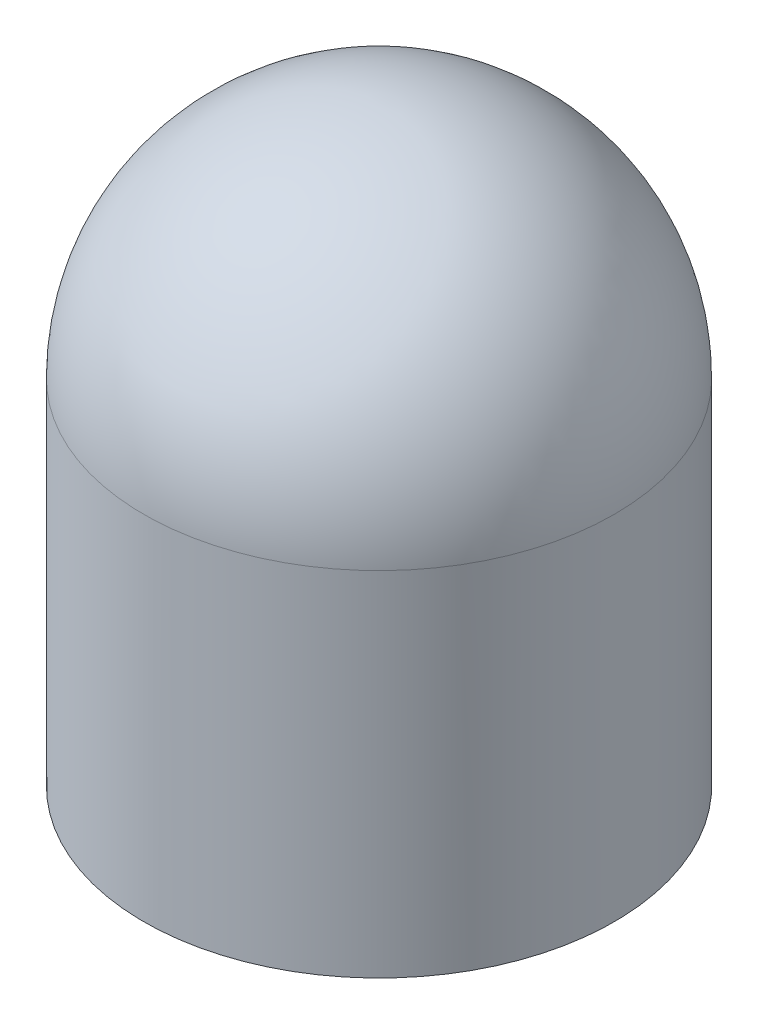
from build123d import *

# Parameters (mm, degrees)
ENL_V_MAT_EXTRU_1_DEPTH = 1


with BuildPart() as part:
    # Esquisse2 → Révolution2 (revolve)
    with BuildSketch(Plane.XY):
        with BuildLine():
            Line((-1.5, -3), (-1.5, -6))
            Line((-1.5, -6), (-4, -6))
            Line((-4, -6), (-4, 0))
            ThreePointArc((-4, 0), (-2.828427125, 2.828427125), (0, 4))
            Line((0, 4), (0, -3))
            Line((0, -3), (-1.5, -3))
        make_face()
    revolve(axis=Axis((0, 4, 0), (0, -1, 0)))

    # Esquisse3 → Enlèv. mat.-Extru.1 (cut)
    with BuildSketch(Plane.XZ.offset(6)):
        with BuildLine():
            add(Edge.make_bspline(
                [(-1.80863124, 2.541345123), (-1.808479721, 2.566576945), (-1.808185465, 2.615578129), (-1.805014729, 2.686862301), (-1.799544973, 2.753773198), (-1.792519265, 2.816312807), (-1.782799384, 2.874524095), (-1.771677826, 2.928435828), (-1.75798753, 2.978054639), (-1.741996794, 3.023469068), (-1.724042414, 3.06548569), (-1.704301487, 3.104630802), (-1.682899044, 3.141401404), (-1.659979633, 3.175784688), (-1.634459695, 3.207014642), (-1.607837422, 3.236160804), (-1.579113212, 3.262654216), (-1.548550296, 3.286362241), (-1.516934602, 3.307796564), (-1.483892299, 3.325862839), (-1.450188991, 3.341600286), (-1.415394884, 3.354330516), (-1.379762252, 3.364219477), (-1.343163483, 3.371125489), (-1.305772607, 3.375881264), (-1.280433508, 3.376250629), (-1.267698248, 3.376436269)],
                knots=[0, 0, 0, 0, 1.622528522, 3.151013738, 4.587225782, 5.939257941, 7.196658267, 8.381214254, 9.47772444, 10.503964975, 11.475138444, 12.414102326, 13.321377868, 14.209997518, 15.068075989, 15.912287155, 16.746865696, 17.577313739, 18.397854368, 19.200328723, 19.996378645, 20.787862277, 21.580050128, 22.371504404, 23.181529048, 24, 24, 24, 24], degree=3))
            add(Edge.make_bspline(
                [(-1.267698248, 3.376436269), (-1.253805469, 3.376070417), (-1.226383591, 3.37534829), (-1.185688202, 3.371418433), (-1.146357234, 3.363478815), (-1.107851049, 3.353522224), (-1.070793349, 3.339911348), (-1.034450069, 3.324259466), (-0.999939833, 3.304434891), (-0.966085568, 3.282749499), (-0.934048036, 3.25774196), (-0.903405408, 3.230569518), (-0.875113051, 3.200304639), (-0.848139657, 3.16798873), (-0.823868807, 3.132356169), (-0.800763662, 3.094654654), (-0.780305532, 3.05394524), (-0.760895229, 3.010948076), (-0.74421092, 2.964519866), (-0.729110025, 2.91492575), (-0.716872402, 2.861547844), (-0.706720882, 2.804552033), (-0.698897695, 2.743842361), (-0.693120072, 2.679563038), (-0.690103596, 2.611653966), (-0.689533129, 2.565198361), (-0.689240215, 2.541345123)],
                knots=[0, 0, 0, 0, 0.875057392, 1.727207867, 2.570264412, 3.399251263, 4.229017074, 5.053828049, 5.887584622, 6.731829445, 7.583639997, 8.443960147, 9.308026848, 10.190032267, 11.091770676, 12.020167189, 12.972467704, 13.958579741, 14.989078804, 16.076606933, 17.221320015, 18.435081626, 19.720875061, 21.074561036, 22.497895074, 24, 24, 24, 24], degree=3))
            add(Edge.make_bspline(
                [(-0.689240215, 2.541345123), (-0.689536199, 2.517598254), (-0.690112578, 2.471355268), (-0.693085762, 2.403758625), (-0.699013134, 2.339828893), (-0.706311275, 2.279386639), (-0.716548088, 2.222615428), (-0.729012582, 2.169485269), (-0.742990504, 2.11971682), (-0.760077838, 2.073746258), (-0.778998468, 2.030799872), (-0.799526075, 1.99045447), (-0.822133943, 1.952630546), (-0.847166636, 1.917738486), (-0.873431331, 1.884680376), (-0.902069059, 1.854605169), (-0.93255791, 1.826939612), (-0.96482414, 1.802036036), (-0.998498431, 1.779578013), (-1.033792029, 1.760620727), (-1.069815262, 1.743794249), (-1.107372434, 1.731042265), (-1.145702223, 1.720159494), (-1.185450047, 1.713129804), (-1.226246928, 1.70847555), (-1.253798722, 1.707844413), (-1.267698248, 1.707526012)],
                knots=[0, 0, 0, 0, 1.496607488, 2.914388442, 4.262485651, 5.541812885, 6.749953981, 7.895567619, 8.980172623, 10.005210728, 10.983286874, 11.936336572, 12.856292636, 13.757107149, 14.640766483, 15.514956722, 16.370989637, 17.232841377, 18.081413197, 18.918442167, 19.755471137, 20.583656588, 21.41504191, 22.264086897, 23.124254193, 24, 24, 24, 24], degree=3))
            add(Edge.make_bspline(
                [(-1.267698248, 1.707526012), (-1.28053559, 1.707744144), (-1.305960862, 1.708176169), (-1.343505356, 1.712413318), (-1.38007908, 1.719445505), (-1.415574616, 1.729301415), (-1.450241362, 1.741814634), (-1.483928981, 1.756972649), (-1.516416052, 1.775327151), (-1.54801261, 1.795949979), (-1.578259763, 1.819406928), (-1.6064329, 1.845919153), (-1.633209394, 1.874853048), (-1.658058785, 1.906520629), (-1.68153021, 1.940717467), (-1.70268935, 1.977765743), (-1.722416535, 2.017269766), (-1.740706112, 2.059533815), (-1.757219877, 2.105292204), (-1.770391091, 2.155440158), (-1.782811418, 2.209430466), (-1.79192615, 2.267809314), (-1.799834358, 2.33013628), (-1.804422361, 2.396815965), (-1.808343164, 2.467627223), (-1.808533454, 2.51632197), (-1.80863124, 2.541345123)],
                knots=[0, 0, 0, 0, 0.82614074, 1.636230647, 2.42850654, 3.22151677, 4.005075515, 4.799112676, 5.596456327, 6.404618302, 7.226350817, 8.05679228, 8.892237205, 9.761873943, 10.645770802, 11.559890835, 12.505927976, 13.487073095, 14.523090282, 15.633895838, 16.822583925, 18.088023083, 19.435493537, 20.865857947, 22.389433785, 24, 24, 24, 24], degree=3))
        make_face()
        with BuildLine():
            add(Edge.make_bspline(
                [(-1.605105599, 2.541981141), (-1.605023852, 2.520672046), (-1.604865594, 2.479419233), (-1.602515721, 2.419724601), (-1.599170136, 2.364139577), (-1.59416568, 2.312679231), (-1.587492401, 2.265267043), (-1.579593913, 2.22196849), (-1.570588452, 2.182700619), (-1.559609283, 2.147398904), (-1.547452492, 2.115233539), (-1.533935704, 2.085621273), (-1.519900759, 2.057891237), (-1.504090822, 2.032593058), (-1.487347707, 2.00938102), (-1.469369083, 1.988343478), (-1.450796759, 1.969019299), (-1.424302992, 1.947561621), (-1.390356536, 1.925127641), (-1.348216049, 1.905674198), (-1.305758021, 1.892833006), (-1.277113233, 1.891405835), (-1.262928115, 1.890699089)],
                knots=[0, 0, 0, 0, 1.564601651, 3.028951736, 4.386019676, 5.653114642, 6.824348509, 7.900668805, 8.88431448, 9.780488761, 10.613163047, 11.407444027, 12.169849642, 12.89344098, 13.595615509, 14.26934431, 14.924332585, 15.560171042, 16.769153194, 17.901006317, 18.960562374, 20, 20, 20, 20], degree=3))
            add(Edge.make_bspline(
                [(-1.262928115, 1.890699089), (-1.246853522, 1.891540168), (-1.214804369, 1.893217091), (-1.167603677, 1.905427209), (-1.122345984, 1.925920174), (-1.086485855, 1.949072591), (-1.05939208, 1.971591143), (-1.039825463, 1.990761174), (-1.02179068, 2.012163191), (-1.004765256, 2.035471294), (-0.989370848, 2.06106677), (-0.974527097, 2.088368697), (-0.961602786, 2.118032092), (-0.95413322, 2.138702882), (-0.950325451, 2.149240255)],
                knots=[0, 0, 0, 0, 1.331887272, 2.655486065, 4.012646414, 5.436183829, 6.178803566, 6.930724497, 7.703763371, 8.496530827, 9.320959298, 10.178042319, 11.071218497, 12, 12, 12, 12], degree=3))
            add(Edge.make_bspline(
                [(-0.950325451, 2.149240255), (-0.945737968, 2.163084868), (-0.936386065, 2.191308069), (-0.924669416, 2.235249723), (-0.914969473, 2.281357725), (-0.906617281, 2.329386525), (-0.90027545, 2.37957809), (-0.895891912, 2.431884075), (-0.893377451, 2.486304801), (-0.892971987, 2.523216067), (-0.892765856, 2.541981141)],
                knots=[0, 0, 0, 0, 0.877617242, 1.789083553, 2.735016418, 3.71249782, 4.722174671, 5.778575778, 6.870664861, 8, 8, 8, 8], degree=3))
            add(Edge.make_bspline(
                [(-0.892765856, 2.541981141), (-0.892815192, 2.560748136), (-0.892911405, 2.597346919), (-0.895770969, 2.650881984), (-0.899229308, 2.701840221), (-0.905195582, 2.750054281), (-0.911872778, 2.795764776), (-0.921031545, 2.838648534), (-0.930854849, 2.879133664), (-0.943127016, 2.916720139), (-0.956544156, 2.951787091), (-0.970695385, 2.984451245), (-0.985996373, 3.014738738), (-1.002854445, 3.04226954), (-1.020647463, 3.06749779), (-1.039441811, 3.090271765), (-1.05951754, 3.110463274), (-1.087584092, 3.133229632), (-1.123765401, 3.156924472), (-1.169007106, 3.178189343), (-1.215723695, 3.190725625), (-1.247275437, 3.192421751), (-1.262928115, 3.193263192)],
                knots=[0, 0, 0, 0, 1.353201578, 2.638969622, 3.865559904, 5.035676431, 6.141732754, 7.195734042, 8.19695873, 9.144657206, 10.044788335, 10.904062871, 11.710933862, 12.489720227, 13.229995877, 13.935715626, 14.616825307, 15.279494989, 16.538995736, 17.725922936, 18.871840505, 20, 20, 20, 20], degree=3))
            add(Edge.make_bspline(
                [(-1.262928115, 3.193263192), (-1.277109142, 3.192542637), (-1.305847895, 3.191082387), (-1.348370358, 3.178419537), (-1.390359144, 3.158811848), (-1.424078124, 3.13636234), (-1.450352786, 3.114927418), (-1.469178663, 3.096042766), (-1.486571406, 3.074886349), (-1.503356006, 3.051861153), (-1.518682213, 3.02639658), (-1.533568016, 2.998957155), (-1.546683445, 2.96908953), (-1.559017747, 2.936899522), (-1.569881275, 2.90153329), (-1.579275962, 2.86232535), (-1.587671251, 2.819074671), (-1.593721707, 2.771566799), (-1.598807927, 2.720028274), (-1.602614415, 2.664356134), (-1.604836941, 2.604541443), (-1.605014092, 2.563289689), (-1.605105599, 2.541981141)],
                knots=[0, 0, 0, 0, 1.039778295, 2.107176824, 3.232337611, 4.43520669, 5.071253539, 5.720927637, 6.389866065, 7.081397607, 7.811854436, 8.571243718, 9.372887587, 10.205834777, 11.102302774, 12.088086757, 13.166194718, 14.33675119, 15.604261439, 16.970055543, 18.43488556, 20, 20, 20, 20], degree=3))
        make_face(mode=Mode.SUBTRACT)
    extrude(amount=-ENL_V_MAT_EXTRU_1_DEPTH, mode=Mode.SUBTRACT)


solid = part.part
